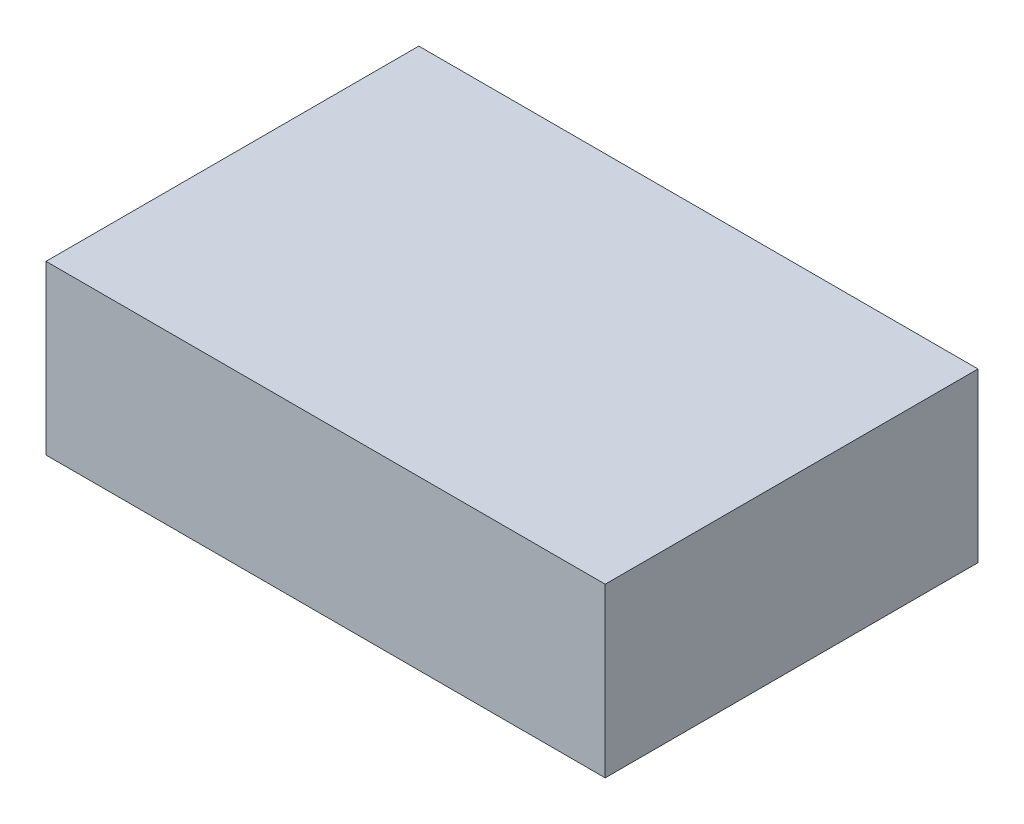
from build123d import *

# Parameters (mm, degrees)
SKETCH2_W           = 30
SKETCH2_H           = 20
BOSS_EXTRUDE1_DEPTH = 9


with BuildPart() as part:
    # Sketch2 → Boss-Extrude1 (new body)
    with BuildSketch(Plane(origin=(0, 0, 0), x_dir=(1, 0, 0), z_dir=(0, 1, 0))):
        Rectangle(SKETCH2_W, SKETCH2_H)
    extrude(amount=BOSS_EXTRUDE1_DEPTH)


solid = part.part
